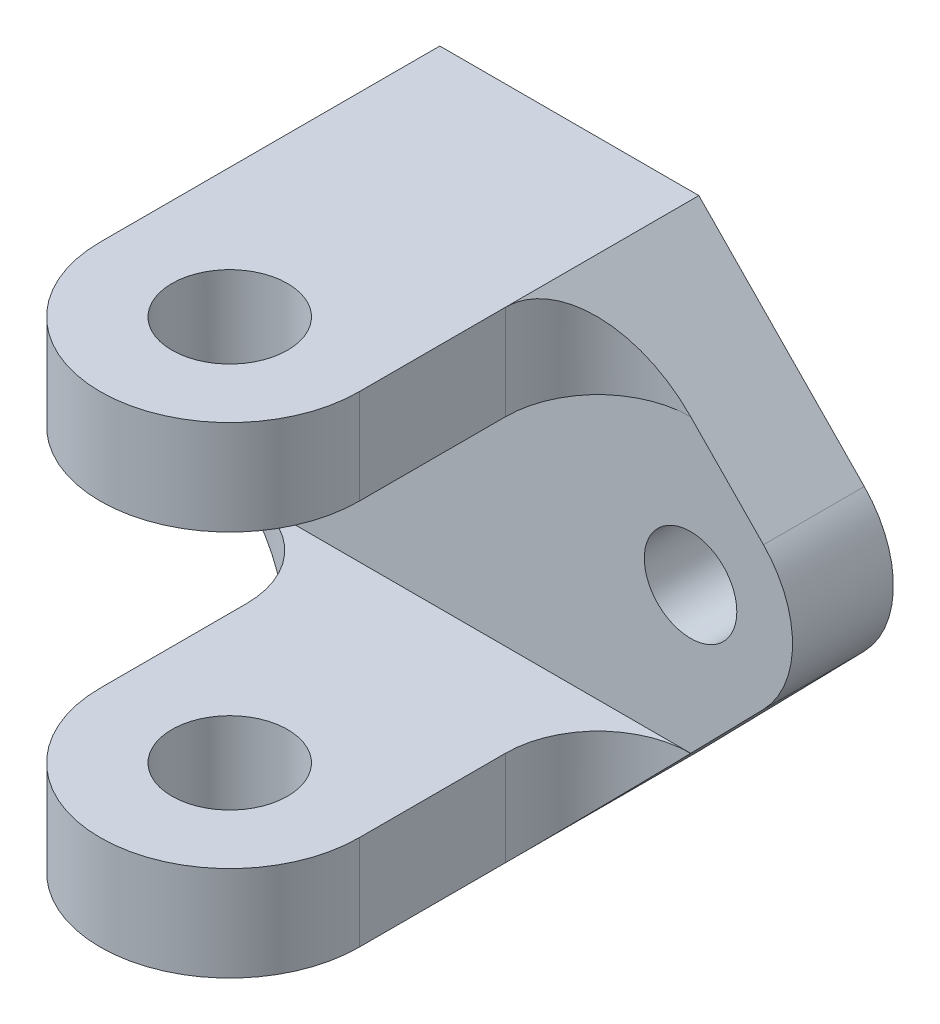
from build123d import *

# Parameters (mm, degrees)
SKETCH1_W                      = 46.48
SKETCH1_H                      = 33.02
SKETCH1_R                      = 3.175
BOSS_EXTRUDE1_DEPTH            = 9.46
SKETCH2_W                      = 46.48
SKETCH2_H                      = 6.51
BOSS_EXTRUDE2_DEPTH            = 53
CUT_EXTRUDE1_REACH             = 70.658
SKETCH4_R                      = 3.96875
CUT_EXTRUDE1_DIRECTION_2_REACH = 70.658
CUT_EXTRUDE3_REACH             = 70.658
CUT_EXTRUDE3_DIRECTION_2_REACH = 70.658
CUT_EXTRUDE4_DEPTH             = 9.46
BOSS_EXTRUDE3_DEPTH            = 9.46
FILLET3_R                      = 6.35
CUT_EXTRUDE5_DEPTH             = 2.54


with BuildPart() as part:
    # Sketch1 → Boss-Extrude1 (new body)
    with BuildSketch(Plane.XY):
        Rectangle(SKETCH1_W, SKETCH1_H)
        with Locations((15.24, 0)):
            Circle(SKETCH1_R, mode=Mode.SUBTRACT)
        with Locations((-15.24, 0)):
            Circle(SKETCH1_R, mode=Mode.SUBTRACT)
    extrude(amount=BOSS_EXTRUDE1_DEPTH)

    # Sketch2 → Boss-Extrude2 (add)
    with BuildSketch(Plane.XY.offset(9.46)):
        with Locations((0, 13.255)):
            Rectangle(SKETCH2_W, SKETCH2_H)
        with Locations((0, -13.255)):
            Rectangle(SKETCH2_W, SKETCH2_H)
    extrude(amount=BOSS_EXTRUDE2_DEPTH)

    # Cut-Extrude1: up to this face of the body (flat: up to its plane)
    cut_extrude1_end = Plane(part.part.faces().sort_by_distance((0, -16.51, 31.23))[0])
    # Sketch4 → Cut-Extrude1 (cut, up to the picked face)
    with BuildSketch(Plane(origin=(0, 0, 0), x_dir=(1, 0, 0), z_dir=(0, 1, 0)), mode=Mode.PRIVATE) as cut_extrude1_sk1:
        with Locations(Location((0, -25.8481308, 0), (0, 0, 270))):
            Circle(SKETCH4_R)
    cut_extrude1_tool1 = split(extrude(cut_extrude1_sk1.sketch, amount=-CUT_EXTRUDE1_REACH, mode=Mode.PRIVATE), bisect_by=cut_extrude1_end, keep=Keep.BOTH, mode=Mode.PRIVATE)
    add(cut_extrude1_tool1.solids().sort_by(Axis((0, 0, 25.848131), (0, -1, 0)))[0], mode=Mode.SUBTRACT)

    # Cut-Extrude1 direction 2: up to this face of the body (flat: up to its plane)
    cut_extrude1_direction_2_end = Plane(part.part.faces().sort_by_distance((0, 16.51, 31.23))[0])
    # Sketch4 → Cut-Extrude1 direction 2 (cut, up to the picked face)
    with BuildSketch(Plane(origin=(0, 0, 0), x_dir=(1, 0, 0), z_dir=(0, 1, 0)), mode=Mode.PRIVATE) as cut_extrude1_direction_2_sk1:
        with Locations(Location((0, -25.8481308, 0), (0, 0, 270))):
            Circle(SKETCH4_R)
    cut_extrude1_direction_2_tool1 = split(extrude(cut_extrude1_direction_2_sk1.sketch, amount=CUT_EXTRUDE1_DIRECTION_2_REACH, mode=Mode.PRIVATE), bisect_by=cut_extrude1_direction_2_end, keep=Keep.BOTH, mode=Mode.PRIVATE)
    add(cut_extrude1_direction_2_tool1.solids().sort_by(Axis((0, 0, 25.848131), (0, 1, 0)))[0], mode=Mode.SUBTRACT)

    # Cut-Extrude3: up to this face of the body (flat: up to its plane)
    cut_extrude3_end = Plane(part.part.faces().sort_by_distance((0, -16.51, 31.323322986))[0])
    # Sketch6 → Cut-Extrude3 (cut, up to the picked face)
    with BuildSketch(Plane(origin=(0, 0, 0), x_dir=(1, 0, 0), z_dir=(0, 1, 0)), mode=Mode.PRIVATE) as cut_extrude3_sk1:
        with BuildLine():
            Line((-8.89, -25.8481308), (-8.89, -17.46))
            Line((-8.89, -17.46), (-8.89, -9.46))
            Line((-8.89, -9.46), (-16.89, -9.46))
            Line((-16.89, -9.46), (-23.24, -9.46))
            Line((-23.24, -9.46), (-23.24, -62.46))
            Line((-23.24, -62.46), (23.24, -62.46))
            Line((23.24, -62.46), (23.24, -9.46))
            Line((23.24, -9.46), (16.89, -9.46))
            Line((16.89, -9.46), (8.89, -9.46))
            Line((8.89, -9.46), (8.89, -17.46))
            Line((8.89, -17.46), (8.89, -25.8481308))
            ThreePointArc((8.89, -25.8481308), (0, -34.7381308), (-8.89, -25.8481308))
        make_face()
    cut_extrude3_tool1 = split(extrude(cut_extrude3_sk1.sketch, amount=-CUT_EXTRUDE3_REACH, mode=Mode.PRIVATE), bisect_by=cut_extrude3_end, keep=Keep.BOTH, mode=Mode.PRIVATE)
    add(cut_extrude3_tool1.solids().sort_by(Axis((0, 0, 38.948856), (0, -1, 0)))[0], mode=Mode.SUBTRACT)

    # Cut-Extrude3 direction 2: up to this face of the body (flat: up to its plane)
    cut_extrude3_direction_2_end = Plane(part.part.faces().sort_by_distance((0, 16.51, 31.323322986))[0])
    # Sketch6 → Cut-Extrude3 direction 2 (cut, up to the picked face)
    with BuildSketch(Plane(origin=(0, 0, 0), x_dir=(1, 0, 0), z_dir=(0, 1, 0)), mode=Mode.PRIVATE) as cut_extrude3_direction_2_sk1:
        with BuildLine():
            Line((-8.89, -25.8481308), (-8.89, -17.46))
            Line((-8.89, -17.46), (-8.89, -9.46))
            Line((-8.89, -9.46), (-16.89, -9.46))
            Line((-16.89, -9.46), (-23.24, -9.46))
            Line((-23.24, -9.46), (-23.24, -62.46))
            Line((-23.24, -62.46), (23.24, -62.46))
            Line((23.24, -62.46), (23.24, -9.46))
            Line((23.24, -9.46), (16.89, -9.46))
            Line((16.89, -9.46), (8.89, -9.46))
            Line((8.89, -9.46), (8.89, -17.46))
            Line((8.89, -17.46), (8.89, -25.8481308))
            ThreePointArc((8.89, -25.8481308), (0, -34.7381308), (-8.89, -25.8481308))
        make_face()
    cut_extrude3_direction_2_tool1 = split(extrude(cut_extrude3_direction_2_sk1.sketch, amount=CUT_EXTRUDE3_DIRECTION_2_REACH, mode=Mode.PRIVATE), bisect_by=cut_extrude3_direction_2_end, keep=Keep.BOTH, mode=Mode.PRIVATE)
    add(cut_extrude3_direction_2_tool1.solids().sort_by(Axis((0, 0, 38.948856), (0, 1, 0)))[0], mode=Mode.SUBTRACT)

    # Sketch7 → Cut-Extrude4 (cut)
    with BuildSketch(Plane.XY):
        with BuildLine():
            ThreePointArc((-15.24, -7), (-22.24, 0), (-15.24, 7))
            Line((-15.24, 7), (-8.89, 7))
            Line((-8.89, 7), (-8.89, 16.51))
            Line((-8.89, 16.51), (-23.24, 16.51))
            Line((-23.24, 16.51), (-23.24, -16.51))
            Line((-23.24, -16.51), (-8.89, -16.51))
            Line((-8.89, -16.51), (-8.89, -7))
            Line((-8.89, -7), (-15.24, -7))
        make_face()
        with BuildLine():
            Line((8.89, 16.51), (8.89, 7))
            Line((8.89, 7), (15.24, 7))
            ThreePointArc((15.24, 7), (22.24, 0), (15.24, -7))
            Line((15.24, -7), (8.89, -7))
            Line((8.89, -7), (8.89, -16.51))
            Line((8.89, -16.51), (23.24, -16.51))
            Line((23.24, -16.51), (23.24, 16.51))
            Line((23.24, 16.51), (8.89, 16.51))
        make_face()
    extrude(amount=CUT_EXTRUDE4_DEPTH, mode=Mode.SUBTRACT)

    # Sketch8 → Boss-Extrude3 (add)
    with BuildSketch(Plane.XY):
        with BuildLine():
            Line((8.89, -16.51), (20.245691258, -4.893164112))
            ThreePointArc((20.245691258, -4.893164112), (17.955497304, -6.451827213), (15.24, -7))
            Line((15.24, -7), (8.89, -7))
            Line((8.89, -7), (8.89, -16.51))
        make_face()
        with BuildLine():
            ThreePointArc((-20.245691258, -4.893164112), (-17.955497304, -6.451827213), (-15.24, -7))
            Line((-15.24, -7), (-8.89, -7))
            Line((-8.89, -7), (-8.89, -16.51))
            Line((-8.89, -16.51), (-20.245691258, -4.893164112))
        make_face()
        with BuildLine():
            Line((8.89, 16.51), (20.245691258, 4.893164112))
            ThreePointArc((20.245691258, 4.893164112), (17.955497304, 6.451827213), (15.24, 7))
            Line((15.24, 7), (8.89, 7))
            Line((8.89, 7), (8.89, 16.51))
        make_face()
        with BuildLine():
            Line((-8.89, 16.51), (-20.245691258, 4.893164112))
            ThreePointArc((-20.245691258, 4.893164112), (-17.955497304, 6.451827213), (-15.24, 7))
            Line((-15.24, 7), (-8.89, 7))
            Line((-8.89, 7), (-8.89, 16.51))
        make_face()
    extrude(amount=BOSS_EXTRUDE3_DEPTH)

    # Fillet3
    fillet3_edges = [part.edges().sort_by_distance(p)[0] for p in [
        (8.89, -13.255, 9.46),
        (-8.89, -13.255, 9.46),
        (8.89, 13.255, 9.46),
        (-8.89, 13.255, 9.46),
    ]]
    fillet(fillet3_edges, radius=FILLET3_R)

    # Sketch10 → Cut-Extrude5 (cut)
    with BuildSketch(Plane.XY):
        with BuildLine():
            Line((-8.89, 16.51), (-20.245691258, 4.893164112))
            ThreePointArc((-20.245691258, 4.893164112), (-22.24, 0), (-20.245691258, -4.893164112))
            Line((-20.245691258, -4.893164112), (-8.89, -16.51))
            Line((-8.89, -16.51), (8.89, -16.51))
            Line((8.89, -16.51), (20.245691258, -4.893164112))
            ThreePointArc((20.245691258, -4.893164112), (22.24, 0), (20.245691258, 4.893164112))
            Line((20.245691258, 4.893164112), (8.89, 16.51))
            Line((8.89, 16.51), (-8.89, 16.51))
        make_face()
    extrude(amount=CUT_EXTRUDE5_DEPTH, mode=Mode.SUBTRACT)


solid = part.part
